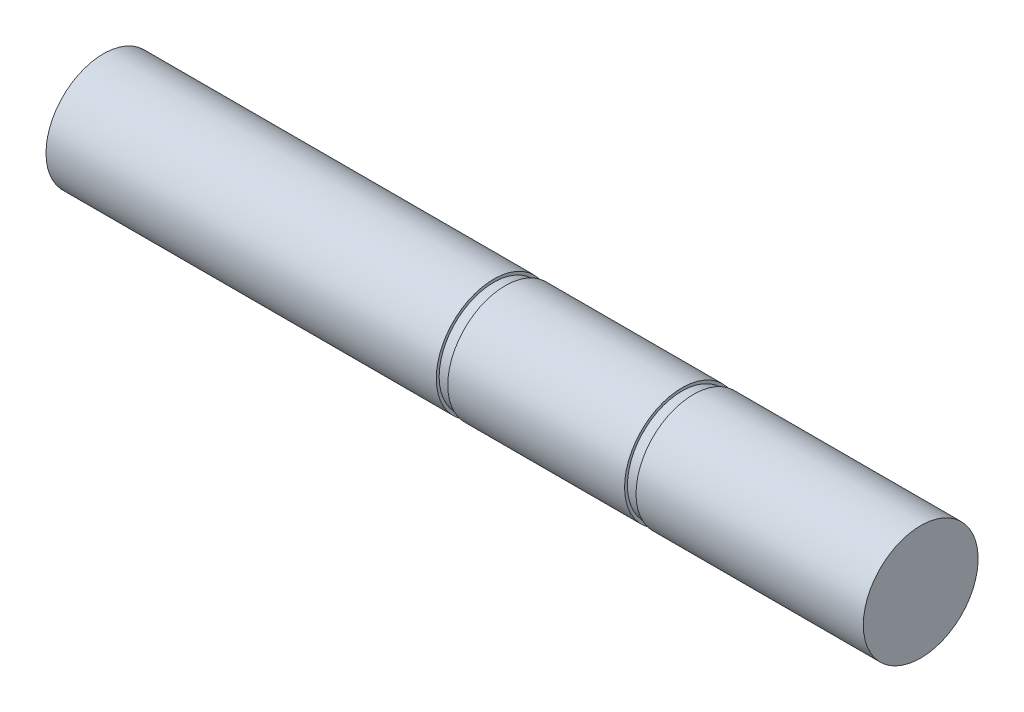
from build123d import *


with BuildPart() as part:
    # Sketch2 → Revolve1 (revolve)
    with BuildSketch(Plane.XY, mode=Mode.PRIVATE) as revolve1_sk:
        Polygon((-0.5, 2.5), (-0.5, 0), (35.1, 0), (35.1, 2.5), (25.2, 2.5), (25.2, 2.375), (24.7, 2.375), (24.7, 2.5), (17, 2.5), (17, 2.375), (16.5, 2.375), (16.5, 2.5), align=None)
    revolve(revolve1_sk.sketch.rotate(Axis((-0.5, 0, 0), (1, 0, 0)), 90), axis=Axis((-0.5, 0, 0), (1, 0, 0)))


solid = part.part
